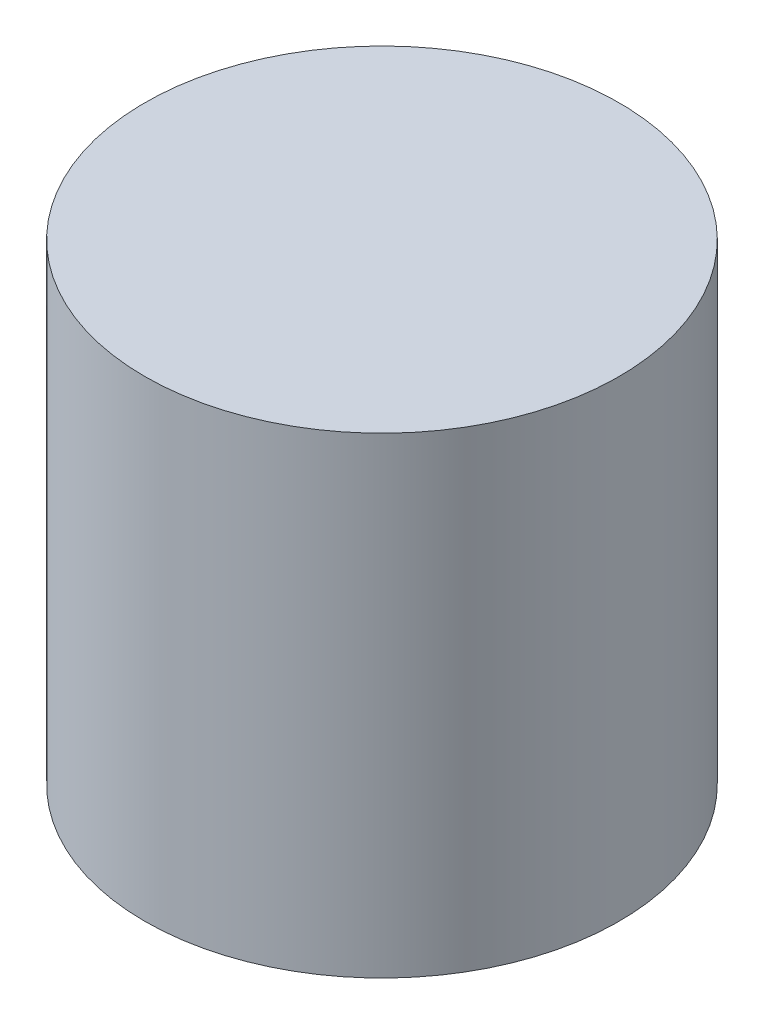
from build123d import *

# Parameters (mm, degrees)
SKETCH1_R           = 39.5
BOSS_EXTRUDE1_DEPTH = 33.9
BOSS_EXTRUDE3_DEPTH = 13.7
BOSS_EXTRUDE4_START = -44.7
SKETCH7_R           = 39.5
SKETCH7_R_2         = 34
BOSS_EXTRUDE4_DEPTH = 44.7
SKETCH8_R           = 8
SKETCH8_R_2         = 2.75
SKETCH8_R_3         = 4.9
CUT_EXTRUDE2_DEPTH  = 19


with BuildPart() as part:
    # Sketch1 → Boss-Extrude1 (new body)
    with BuildSketch(Plane(origin=(0, 0, 0), x_dir=(1, 0, 0), z_dir=(0, 1, 0))):
        with Locations(Location((0, 0, 0), (0, 0, 270))):
            Circle(SKETCH1_R)
    extrude(amount=BOSS_EXTRUDE1_DEPTH)

    # Sketch6 → Boss-Extrude3 (add)
    with BuildSketch(Plane(origin=(0, 0, 0), x_dir=(1, 0, 0), z_dir=(0, 1, 0))):
        with BuildLine():
            Line((29.737090224, 12.56), (-29.737090224, 12.56))
            ThreePointArc((-29.737090224, 12.56), (-29.806512789, 14.933347645), (-29, 17.166537216))
            ThreePointArc((-29, 17.166537216), (-33.7, 0), (-29, -17.166537216))
            ThreePointArc((-29, -17.166537216), (-29.806512789, -14.933347645), (-29.737090224, -12.56))
            Line((-29.737090224, -12.56), (29.737090224, -12.56))
            ThreePointArc((29.737090224, -12.56), (29.806512789, -14.933347645), (29, -17.166537216))
            ThreePointArc((29, -17.166537216), (33.7, 0), (29, 17.166537216))
            ThreePointArc((29, 17.166537216), (29.806512789, 14.933347645), (29.737090224, 12.56))
        make_face()
    extrude(amount=-BOSS_EXTRUDE3_DEPTH)

    # Sketch7 → Boss-Extrude4 (add)
    with BuildSketch(Plane(origin=(0, 0, 0), x_dir=(1, 0, 0), z_dir=(0, 1, 0)).offset(BOSS_EXTRUDE4_START)):
        with Locations(Location((0, 0, 0), (0, 0, 270))):
            Circle(SKETCH7_R)
        with Locations(Location((0, 0, 0), (0, 0, 270))):
            Circle(SKETCH7_R_2, mode=Mode.SUBTRACT)
    extrude(amount=BOSS_EXTRUDE4_DEPTH)

    # Sketch8 → Cut-Extrude2 (cut)
    with BuildSketch(Plane(origin=(0, 0, 0), x_dir=(1, 0, 0), z_dir=(0, 1, 0))):
        with Locations(Location((0, -23.44, 0), (0, 0, 270))):
            Circle(SKETCH8_R)
        with Locations(Location((12.5, -26.56, 0), (0, 0, 270))):
            Circle(SKETCH8_R_2)
        with Locations(Location((20, -19.06, 0), (0, 0, 270))):
            Circle(SKETCH8_R_3)
        with Locations(Location((-12.5, -26.56, 0), (0, 0, 90))):
            Circle(SKETCH8_R_2)
        with Locations(Location((-20, -19.06, 0), (0, 0, 90))):
            Circle(SKETCH8_R_3)
    extrude(amount=CUT_EXTRUDE2_DEPTH, mode=Mode.SUBTRACT)


solid = part.part
